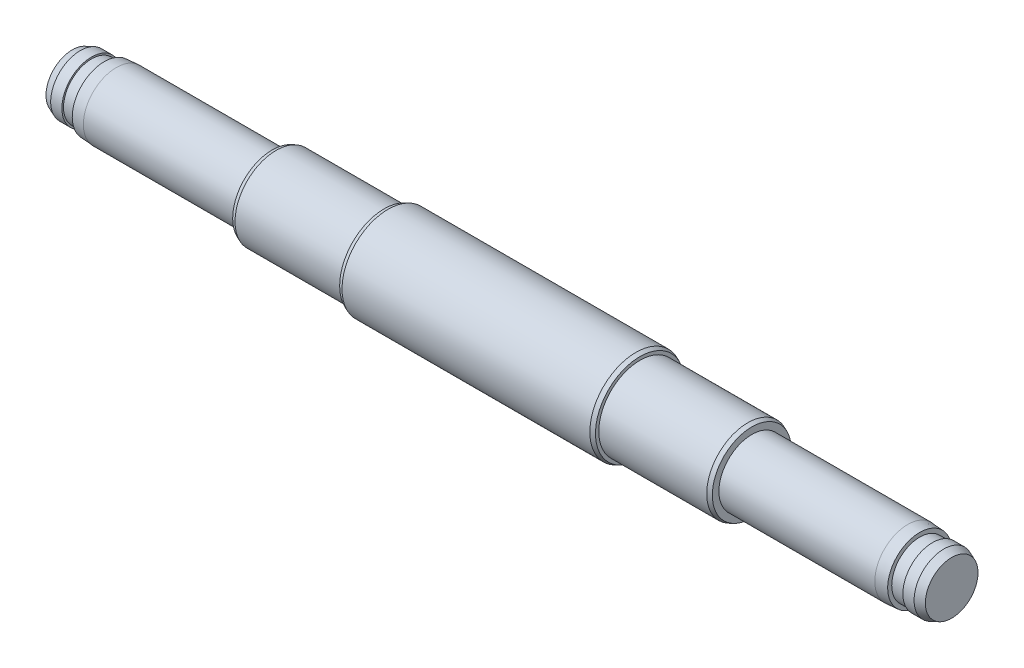
from build123d import *
from OCP.BRepFilletAPI import BRepFilletAPI_MakeChamfer

# Parameters (mm, degrees)
CHAMFER_1_SIZE      = 1.5
CHAMFER_1_SIZE2     = 0.264490471
CHAMFER_2_SIZE      = 1
SKETCH_2_W          = 1.6
SKETCH_2_H          = 2.408745076
SKETCH_3_R          = 14
SKETCH_3_R_2        = 12.5
CUT_EXTRUDE_1_DEPTH = 14
CHAMFER_3_SIZE      = 0.5
CHAMFER_4_SIZE      = 0.5
SCALE5_SCALE_X      = 0.85
SCALE5_SCALE_Y      = 0.35
SCALE5_SCALE_Z      = 0.35


with BuildPart() as part:
    # Эскиз1 → Повернуть1 (revolve)
    with BuildSketch(Plane.XY):
        Polygon((0, 0), (0, 14), (30, 14), (30, 10), (51, 10), (51, 9), (55, 9), (55, 0), align=None)
    revolve(axis=Axis((0, 0, 0), (1, 0, 0)))

    # Зеркальное отражение1: part across plane


with BuildPart() as part_1:
    add(part.part)
    add(part.part.mirror(Plane(origin=(0, 0, 0), x_dir=(0, 0, 1), z_dir=(1, 0, 0))))

    # Фаска1: one chamfer whose edges measure the first distance from different faces: ONE call of the kernel's chamfer builder (chamfer() names one face for all edges)
    chamfer_1_edges_1 = [part_1.edges().sort_by_distance(p)[0] for p in [
        (51, -10, 0),
    ]]
    chamfer_1_side_1 = [part_1.faces().sort_by_distance(p)[0] for p in [
        (40.5, -10, 0),
    ]]
    chamfer_1_edges_2 = [part_1.edges().sort_by_distance(p)[0] for p in [
        (-51, -10, 0),
    ]]
    chamfer_1_side_2 = [part_1.faces().sort_by_distance(p)[0] for p in [
        (-40.5, -10, 0),
    ]]
    chamfer_1 = BRepFilletAPI_MakeChamfer(part_1.part.solid().wrapped)
    for e in chamfer_1_edges_1:
        chamfer_1.Add(CHAMFER_1_SIZE, CHAMFER_1_SIZE2, e.wrapped, chamfer_1_side_1[0].wrapped)  # the first distance lies on this face
    for e in chamfer_1_edges_2:
        chamfer_1.Add(CHAMFER_1_SIZE, CHAMFER_1_SIZE2, e.wrapped, chamfer_1_side_2[0].wrapped)  # the first distance lies on this face
    add(Compound.cast(chamfer_1.Shape()), mode=Mode.REPLACE)

    # Фаска2
    chamfer_2_edges = [part_1.edges().sort_by_distance(p)[0] for p in [
        (55, -9, 0),
        (-55, -9, 0),
    ]]
    chamfer(chamfer_2_edges, length=CHAMFER_2_SIZE)

    # Эскиз2 → Вырез-Повернуть1 (revolve, cut)
    with BuildSketch(Plane(origin=(0, 0, 0), x_dir=(1, 0, 0), z_dir=(0, 1, 0))):
        with Locations((51.8, 9.704372538)):
            Rectangle(SKETCH_2_W, SKETCH_2_H)
    cut_revolve_1 = revolve(axis=Axis((0, 0, 0), (1, 0, 0)), mode=Mode.SUBTRACT)

    # Зеркальное отражение2: Вырез-Повернуть1 across plane
    add(cut_revolve_1.mirror(Plane(origin=(0, 0, 0), x_dir=(0, 0, 1), z_dir=(1, 0, 0))), mode=Mode.SUBTRACT)

    # Эскиз3 → Вырез-Вытянуть1 (cut)
    with BuildSketch(Plane.ZY.offset(30)):
        Circle(SKETCH_3_R)
        Circle(SKETCH_3_R_2, mode=Mode.SUBTRACT)
    cut_extrude_1 = extrude(amount=-CUT_EXTRUDE_1_DEPTH, mode=Mode.SUBTRACT)

    # Зеркальное отражение3: Вырез-Вытянуть1 across plane
    add(cut_extrude_1.mirror(Plane(origin=(0, 0, 0), x_dir=(0, 0, 1), z_dir=(1, 0, 0))), mode=Mode.SUBTRACT)

    # Фаска3
    chamfer_3_edges = [part_1.edges().sort_by_distance(p)[0] for p in [
        (30, 0, -12.5),
        (-30, 0, -12.5),
    ]]
    chamfer(chamfer_3_edges, length=CHAMFER_3_SIZE)

    # Фаска4
    chamfer_4_edges = [part_1.edges().sort_by_distance(p)[0] for p in [
        (16, -14, 0),
        (-16, -14, 0),
    ]]
    chamfer(chamfer_4_edges, length=CHAMFER_4_SIZE)


with BuildPart() as part_2:
    # Scale5: scaled about (0, 0, 0)
    add(part_1.part.scale((SCALE5_SCALE_X, SCALE5_SCALE_Y, SCALE5_SCALE_Z), about=(0, 0, 0)))


solid = part_2.part
